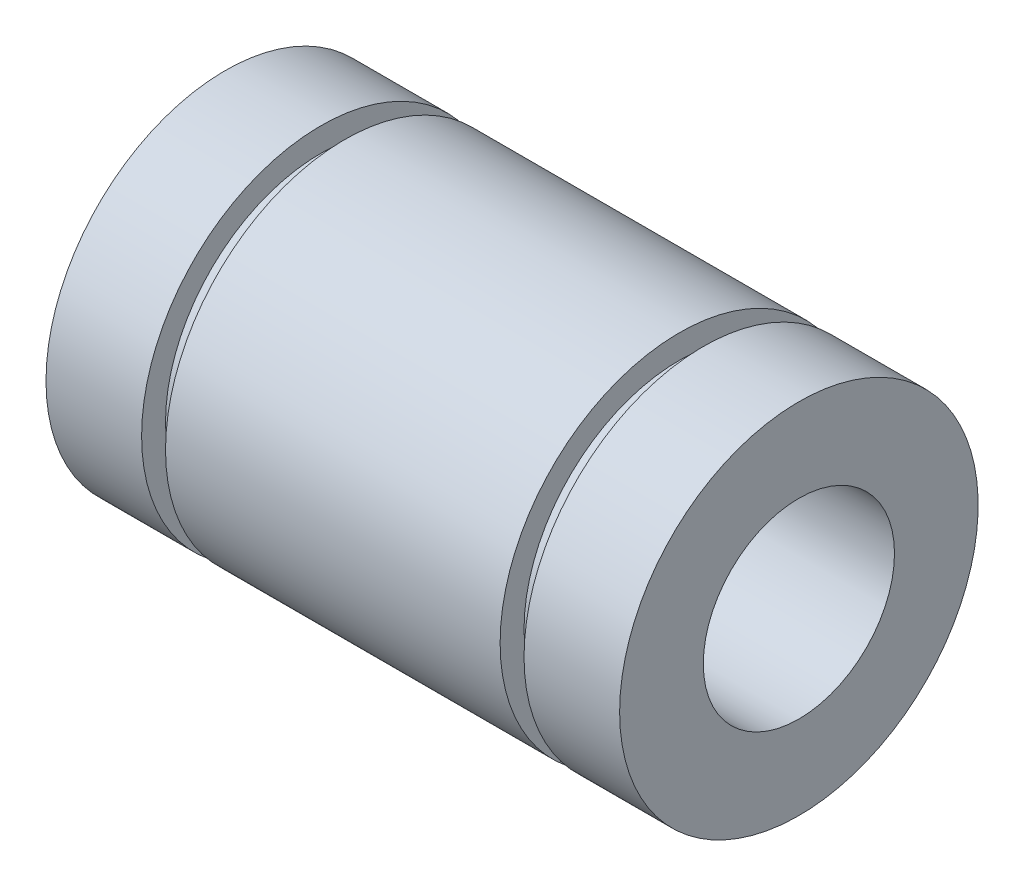
from build123d import *


with BuildPart() as part:
    # Esquisse1 → Révolution1 (revolve)
    with BuildSketch(Plane.XY, mode=Mode.PRIVATE) as r_volution1_sk:
        Polygon((0, 4), (0, 7.5), (4, 7.5), (4, 6.5), (5, 6.5), (5, 7.5), (19, 7.5), (19, 6.5), (20, 6.5), (20, 7.5), (24, 7.5), (24, 4), align=None)
    revolve(r_volution1_sk.sketch.rotate(Axis((0, 0, 0), (1, 0, 0)), 90), axis=Axis((0, 0, 0), (1, 0, 0)))


solid = part.part
